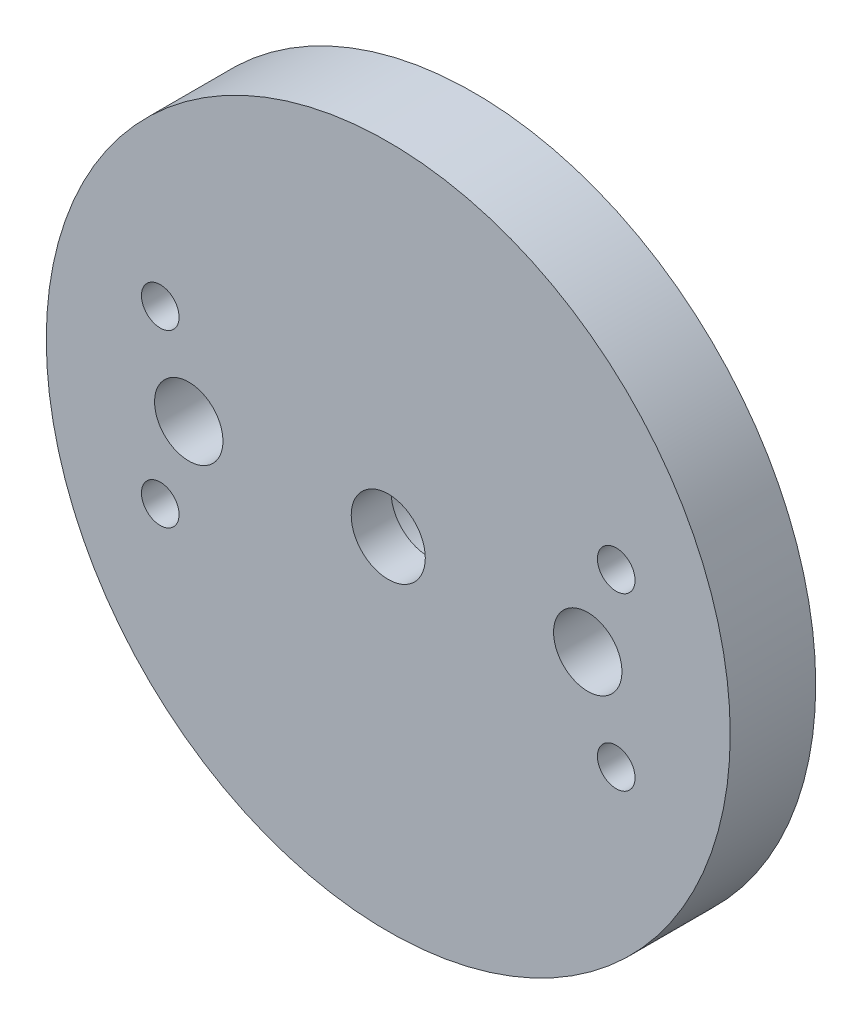
from build123d import *

# Parameters (mm, degrees)
SKETCH_1_R          = 60
EXTRUDE_1_DEPTH     = 15
SKETCH_2_R          = 6
CUT_EXTRUDE_1_DEPTH = 87.168439698
SKETCH_3_R          = 11
CUT_EXTRUDE_2_DEPTH = 8
SKETCH_4_R          = 6.5
CUT_EXTRUDE_3_DEPTH = 10
SKETCH_5_R          = 3.3
CUT_EXTRUDE_4_DEPTH = 10


with BuildPart() as part:
    # 草图1 → 凸台-拉伸1 (new body)
    with BuildSketch(Plane.XY):
        Circle(SKETCH_1_R)
    extrude(amount=EXTRUDE_1_DEPTH)

    # 草图2 → 切除-拉伸1 (cut, through all)
    with BuildSketch(Plane(origin=(0, 0, 0), x_dir=(-1, 0, 0), z_dir=(0, 0, -1))):
        with Locations((-35, 0)):
            Circle(SKETCH_2_R)
        with Locations((35, 0)):
            Circle(SKETCH_2_R)
    extrude(amount=-CUT_EXTRUDE_1_DEPTH, mode=Mode.SUBTRACT)

    # 草图3 → 切除-拉伸2 (cut)
    with BuildSketch(Plane(origin=(0, 0, 0), x_dir=(-1, 0, 0), z_dir=(0, 0, -1))):
        Circle(SKETCH_3_R)
    extrude(amount=-CUT_EXTRUDE_2_DEPTH, mode=Mode.SUBTRACT)

    # 草图4 → 切除-拉伸3 (cut)
    with BuildSketch(Plane(origin=(0, 0, 8), x_dir=(-1, 0, 0), z_dir=(0, 0, -1))):
        Circle(SKETCH_4_R)
    extrude(amount=-CUT_EXTRUDE_3_DEPTH, mode=Mode.SUBTRACT)

    # 草图5 → 切除-拉伸4 (cut)
    with BuildSketch(Plane.XY.offset(15)):
        with Locations((40, 15)):
            Circle(SKETCH_5_R)
        with Locations((40, -15)):
            Circle(SKETCH_5_R)
        with Locations((-40, -15)):
            Circle(SKETCH_5_R)
        with Locations((-40, 15)):
            Circle(SKETCH_5_R)
    extrude(amount=-CUT_EXTRUDE_4_DEPTH, mode=Mode.SUBTRACT)


solid = part.part
